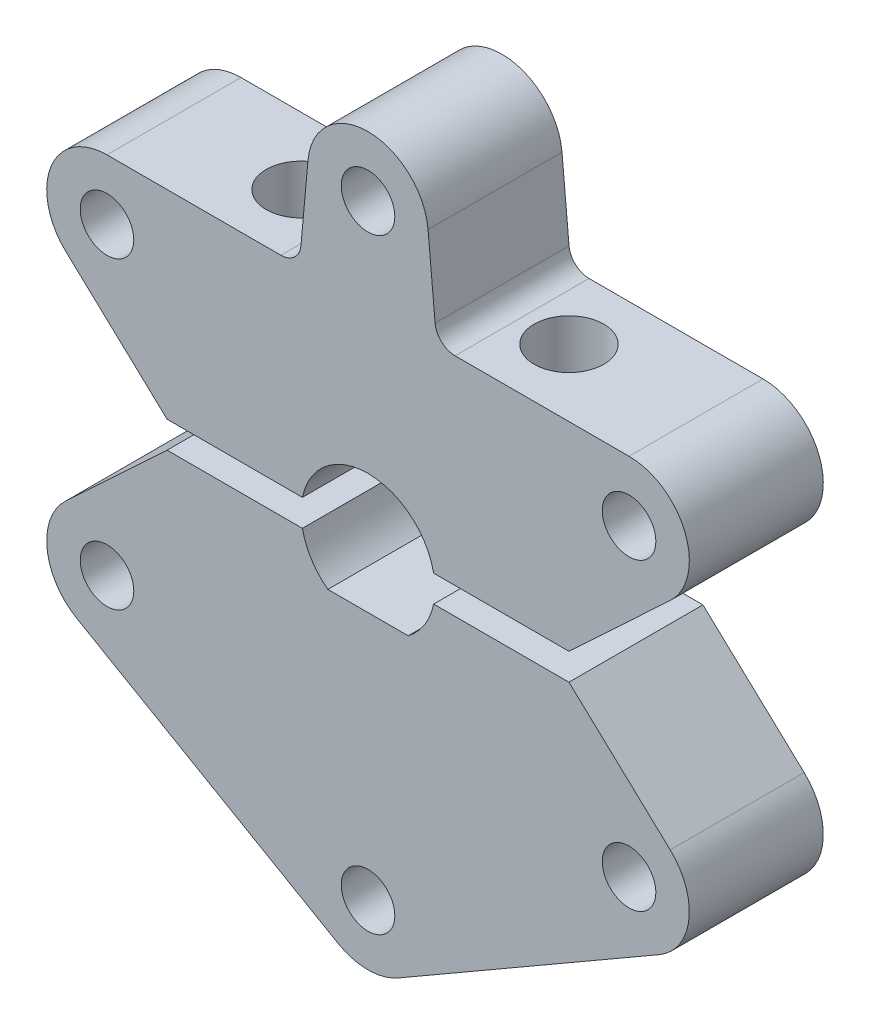
from build123d import *

# Parameters (mm, degrees)
SKETCH_1_R          = 2
EXTRUDE_1_DEPTH     = 10
EXTRUDE_1_2_DEPTH   = 10
SKETCH_2_R          = 2.6
CUT_EXTRUDE_1_DEPTH = 14.85
SKETCH_3_R          = 2
CUT_EXTRUDE_2_DEPTH = 51.199702631


with BuildPart() as part:
    # 草图1 → 凸台-拉伸1 (new body)
    with BuildSketch(Plane.XY):
        with BuildLine():
            Line((-3, -4), (3, -4))
            ThreePointArc((3, -4), (4.224744871, -2.674234614), (4.898979486, -1))
            Line((4.898979486, -1), (15, -1))
            Line((15, -1), (22.557859125, -8.061983991))
            ThreePointArc((22.557859125, -8.061983991), (23.956389252, -11.861653581), (21.735571585, -15.247114317))
            Line((21.735571585, -15.247114317), (2.25, -26.497114317))
            ThreePointArc((2.25, -26.497114317), (0, -27.1), (-2.25, -26.497114317))
            Line((-2.25, -26.497114317), (-21.735571585, -15.247114317))
            ThreePointArc((-21.735571585, -15.247114317), (-23.956389252, -11.861653581), (-22.557859125, -8.061983991))
            Line((-22.557859125, -8.061983991), (-15, -1))
            Line((-15, -1), (-4.898979486, -1))
            ThreePointArc((-4.898979486, -1), (-4.224744871, -2.674234614), (-3, -4))
        make_face()
        with Locations((-19.485571585, -11.35)):
            Circle(SKETCH_1_R, mode=Mode.SUBTRACT)
        with Locations((0, -22.6)):
            Circle(SKETCH_1_R, mode=Mode.SUBTRACT)
        with Locations((19.485571585, -11.35)):
            Circle(SKETCH_1_R, mode=Mode.SUBTRACT)
    extrude(amount=EXTRUDE_1_DEPTH)

    # 草图3 → 切除-拉伸2 (cut, through all)
    with BuildSketch(Plane(origin=(0, 15.85, 0), x_dir=(1, 0, 0), z_dir=(0, 1, 0))):
        with Locations(Location((-10, -5, 0), (0, 0, 180))):
            Circle(SKETCH_3_R)
        with Locations((10, -5)):
            Circle(SKETCH_3_R)
    extrude(amount=-CUT_EXTRUDE_2_DEPTH, mode=Mode.SUBTRACT)


with BuildPart() as body_2:
    # 草图1 → Extrude 1 2 (new body)
    with BuildSketch(Plane.XY):
        with BuildLine():
            Line((-15, 1), (-22.557859125, 8.061983991))
            ThreePointArc((-22.557859125, 8.061983991), (-23.671624143, 13.001352167), (-19.485571585, 15.85))
            Line((-19.485571585, 15.85), (-6.5, 15.85))
            ThreePointArc((-6.5, 15.85), (-5.488301483, 16.242540696), (-5.006113419, 17.214711852))
            Line((-5.006113419, 17.214711852), (-4.481659743, 23.005864444))
            ThreePointArc((-4.481659743, 23.005864444), (0, 27.1), (4.481659743, 23.005864444))
            Line((4.481659743, 23.005864444), (5.006113419, 17.214711852))
            ThreePointArc((5.006113419, 17.214711852), (5.488301483, 16.242540696), (6.5, 15.85))
            Line((6.5, 15.85), (19.485571585, 15.85))
            ThreePointArc((19.485571585, 15.85), (23.671624143, 13.001352167), (22.557859125, 8.061983991))
            Line((22.557859125, 8.061983991), (15, 1))
            Line((15, 1), (4.898979486, 1))
            ThreePointArc((4.898979486, 1), (0, 5), (-4.898979486, 1))
            Line((-4.898979486, 1), (-15, 1))
        make_face()
        with Locations((-19.485571585, 11.35)):
            Circle(SKETCH_1_R, mode=Mode.SUBTRACT)
        with Locations((0, 22.6)):
            Circle(SKETCH_1_R, mode=Mode.SUBTRACT)
        with Locations((19.485571585, 11.35)):
            Circle(SKETCH_1_R, mode=Mode.SUBTRACT)
    extrude(amount=EXTRUDE_1_2_DEPTH)

    # 草图2 → 切除-拉伸1 (cut)
    with BuildSketch(Plane(origin=(0, 15.85, 0), x_dir=(1, 0, 0), z_dir=(0, 1, 0))):
        with Locations(Location((-10, -5, 0), (0, 0, 180))):
            Circle(SKETCH_2_R)
        with Locations(Location((10, -5, 0), (0, 0, 180))):
            Circle(SKETCH_2_R)
    extrude(amount=-CUT_EXTRUDE_1_DEPTH, mode=Mode.SUBTRACT)


solid = Compound([part.part, body_2.part])
